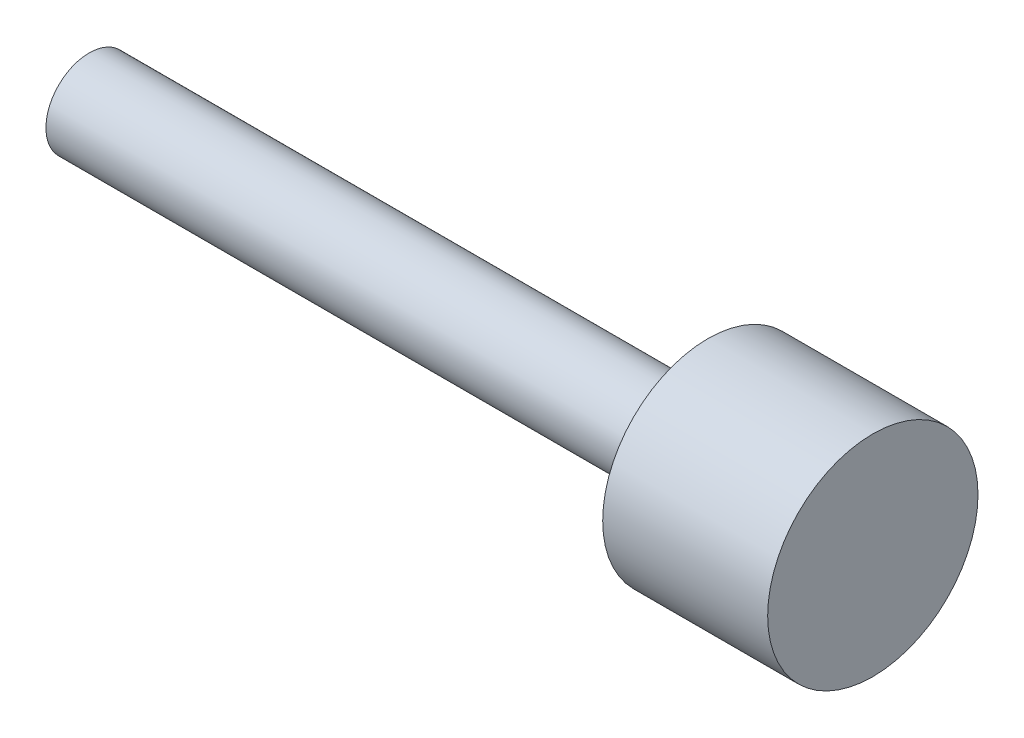
from build123d import *

# Parameters (mm, degrees)
BOSS_EXTRUDE1_START = 5
SKETCH2_R           = 5.1
BOSS_EXTRUDE1_DEPTH = 5


with BuildPart() as part:
    # Sketch1 → Revolve1 (revolve)
    with BuildSketch(Plane.XY, mode=Mode.PRIVATE) as revolve1_sk:
        Polygon((0, 0), (0, 2.1), (30, 2.1), (30, 5.1), (33, 5.1), (33, 0), align=None)
    revolve(revolve1_sk.sketch.rotate(Axis((33, 0, 0), (-1, 0, 0)), 90), axis=Axis((33, 0, 0), (-1, 0, 0)))

    # Sketch2 → Boss-Extrude1 (add)
    with BuildSketch(Plane(origin=(33, 0, 0), x_dir=(0, 0, -1), z_dir=(1, 0, 0)).offset(BOSS_EXTRUDE1_START)):
        Circle(SKETCH2_R)
    extrude(amount=-BOSS_EXTRUDE1_DEPTH)


solid = part.part
